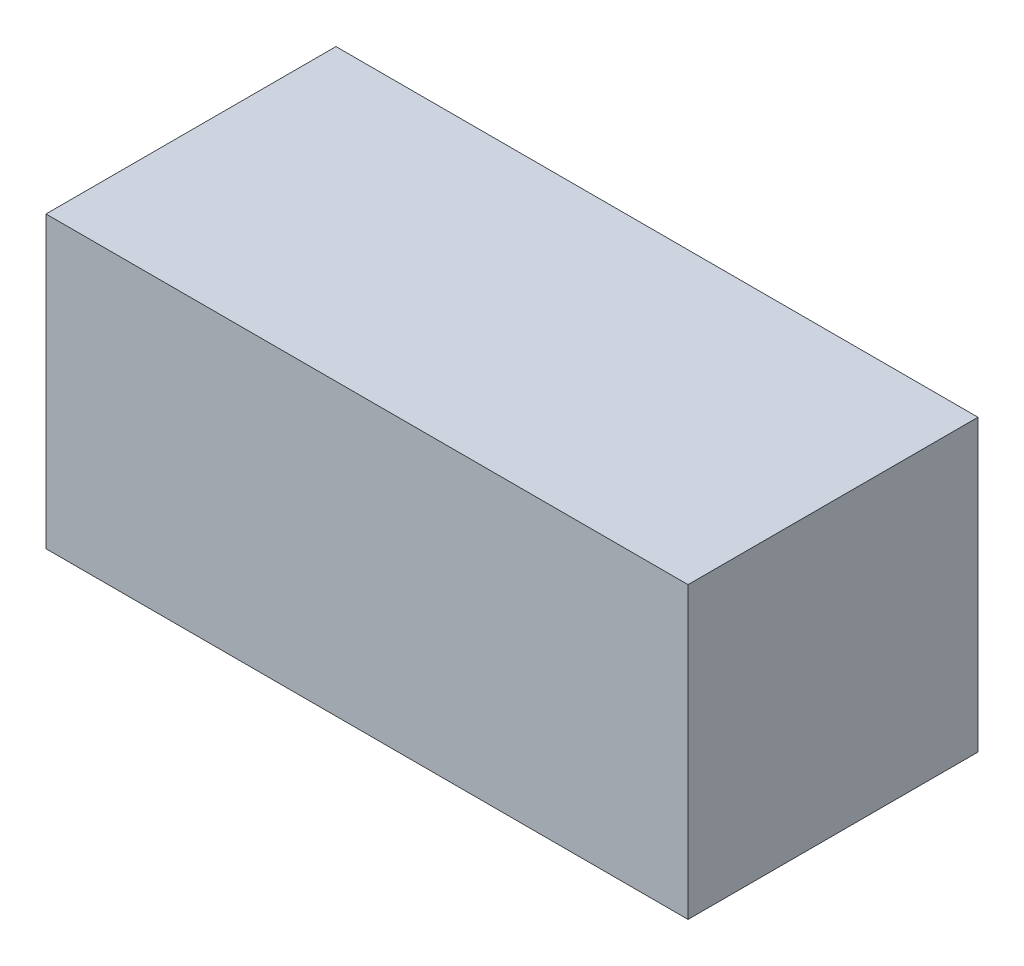
from build123d import *

# Parameters (mm, degrees)
ESQUISSE1_W             = 155
ESQUISSE1_H             = 70
BOSS_EXTRU_1_DEPTH      = 70
ESQUISSE2_W             = 62
ESQUISSE2_H             = 62
ENL_V_MAT_EXTRU_1_DEPTH = 151
ESQUISSE3_R             = 2.5
ENL_V_MAT_EXTRU_2_DEPTH = 5


with BuildPart() as part:
    # Esquisse1 → Boss.-Extru.1 (new body)
    with BuildSketch(Plane.XY):
        with Locations((12.385350745, -11.363216266)):
            Rectangle(ESQUISSE1_W, ESQUISSE1_H)
    extrude(amount=BOSS_EXTRU_1_DEPTH)

    # Esquisse2 → Enlèv. mat.-Extru.1 (cut)
    with BuildSketch(Plane.ZY.offset(65.114649255)):
        with Locations((35, -11.363216266)):
            Rectangle(ESQUISSE2_W, ESQUISSE2_H)
    extrude(amount=-ENL_V_MAT_EXTRU_1_DEPTH, mode=Mode.SUBTRACT)

    # Esquisse3 → Enlèv. mat.-Extru.2 (cut)
    with BuildSketch(Plane.XZ.offset(46.363216266)):
        with Locations(Location((-60.114649255, 35, 0), (0, 0, 270))):
            Circle(ESQUISSE3_R)
        with Locations(Location((49.885350745, 35, 0), (0, 0, 270))):
            Circle(ESQUISSE3_R)
    extrude(amount=-ENL_V_MAT_EXTRU_2_DEPTH, mode=Mode.SUBTRACT)


solid = part.part
